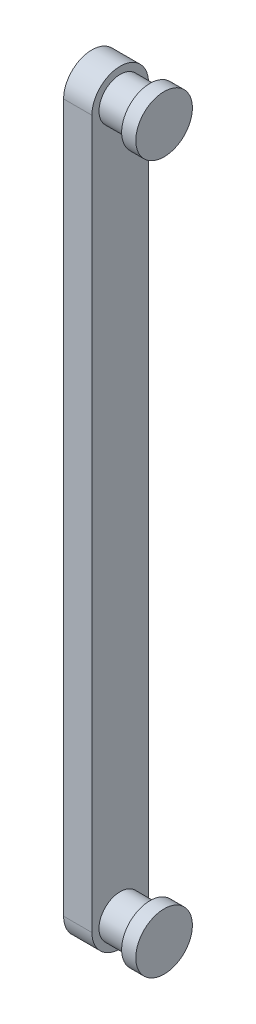
from build123d import *

# Parameters (mm, degrees)
BASE_DEPTH         = 2
ESQUISSE2_R        = 1.5
BOSS_FIX_DEPTH     = 2.1
ESQUISSE3_R        = 2
BOSS_BLOCAGE_DEPTH = 1


with BuildPart() as part:
    # Esquisse1 → BASE (new body)
    with BuildSketch(Plane(origin=(0, 0, 0), x_dir=(0, 0, -1), z_dir=(1, 0, 0))):
        with BuildLine():
            Line((2, 25), (2, -25))
            ThreePointArc((2, -25), (0, -27), (-2, -25))
            Line((-2, -25), (-2, 25))
            ThreePointArc((-2, 25), (0, 27), (2, 25))
        make_face()
    extrude(amount=BASE_DEPTH)

    # Esquisse2 → BOSS FIX (add)
    with BuildSketch(Plane(origin=(2, 0, 0), x_dir=(0, 0, -1), z_dir=(1, 0, 0))):
        with Locations(Location((0, 25, 0), (0, 0, 180))):
            Circle(ESQUISSE2_R)
    boss_fix = extrude(amount=BOSS_FIX_DEPTH)

    # Esquisse3 → BOSS BLOCAGE (add)
    with BuildSketch(Plane(origin=(4.1, 0, 0), x_dir=(0, 0, -1), z_dir=(1, 0, 0))):
        with Locations((0, 25)):
            Circle(ESQUISSE3_R)
    boss_blocage = extrude(amount=BOSS_BLOCAGE_DEPTH)

    # SYM FIXATION: BOSS FIX, BOSS BLOCAGE across plane
    add(boss_fix.mirror(Plane.ZX))
    add(boss_blocage.mirror(Plane.ZX))


solid = part.part
